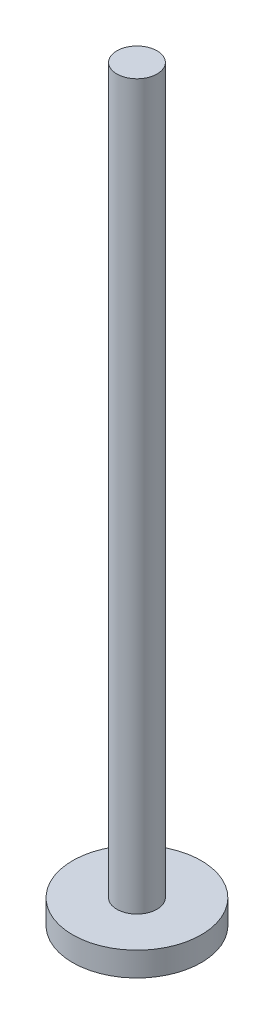
from build123d import *

# Parameters (mm, degrees)
SKETCH_1_R      = 8
EXTRUDE_1_DEPTH = 3
SKETCH_2_R      = 2.5
EXTRUDE_2_DEPTH = 90


with BuildPart() as part:
    # 草图1 → 凸台-拉伸1 (new body)
    with BuildSketch(Plane(origin=(0, 0, 0), x_dir=(1, 0, 0), z_dir=(0, 1, 0))):
        with Locations(Location((0, 0, 0), (0, 0, 270))):
            Circle(SKETCH_1_R)
    extrude(amount=EXTRUDE_1_DEPTH)

    # 草图2 → 凸台-拉伸2 (add)
    with BuildSketch(Plane(origin=(0, 3, 0), x_dir=(1, 0, 0), z_dir=(0, 1, 0))):
        with Locations(Location((0, 0, 0), (0, 0, 90))):
            Circle(SKETCH_2_R)
    extrude(amount=EXTRUDE_2_DEPTH)


solid = part.part
